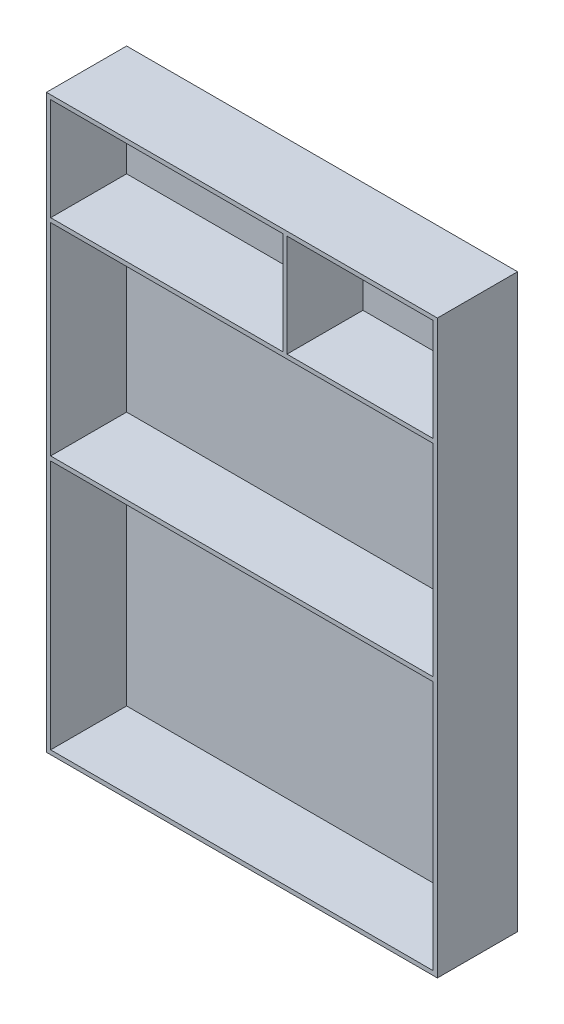
from build123d import *

# Parameters (mm, degrees)
SKETCH1_W           = 230.223051784
SKETCH1_H           = 338.919319135
BOSS_EXTRUDE1_DEPTH = 45.72
SHELL1_T            = 2.54
BOSS_EXTRUDE2_DEPTH = 45.72


with BuildPart() as part:
    # Sketch1 → Boss-Extrude1 (new body)
    with BuildSketch(Plane.XY):
        with Locations((20.509326923, 46.836837465)):
            Rectangle(SKETCH1_W, SKETCH1_H)
    extrude(amount=BOSS_EXTRUDE1_DEPTH)

    # Shell1
    shell1_openings = [part.faces().sort_by_distance(p)[0] for p in [
        (20.509326923, 46.836837464, 45.72),
    ]]
    offset(amount=SHELL1_T, openings=shell1_openings, kind=Kind.INTERSECTION)

    # Sketch2 → Boss-Extrude2 (add)
    with BuildSketch(Plane.XY):
        Polygon((45.097801031, 154.743483449), (-94.602198969, 154.743483449), (-94.602198969, 152.203483449), (-84.918790084, 152.203483449), (135.620852815, 152.203483449), (135.620852815, 154.743483449), (47.637801031, 154.743483449), (47.637801031, 216.296497032), (45.097801031, 216.296497032), align=None)
        Polygon((-94.602198969, 29.235642098), (-94.602198969, 30.557556356), (135.620852815, 30.557556356), (135.620852815, 27.965642098), (-94.602198969, 27.965642098), align=None)
    extrude(amount=BOSS_EXTRUDE2_DEPTH)


solid = part.part
